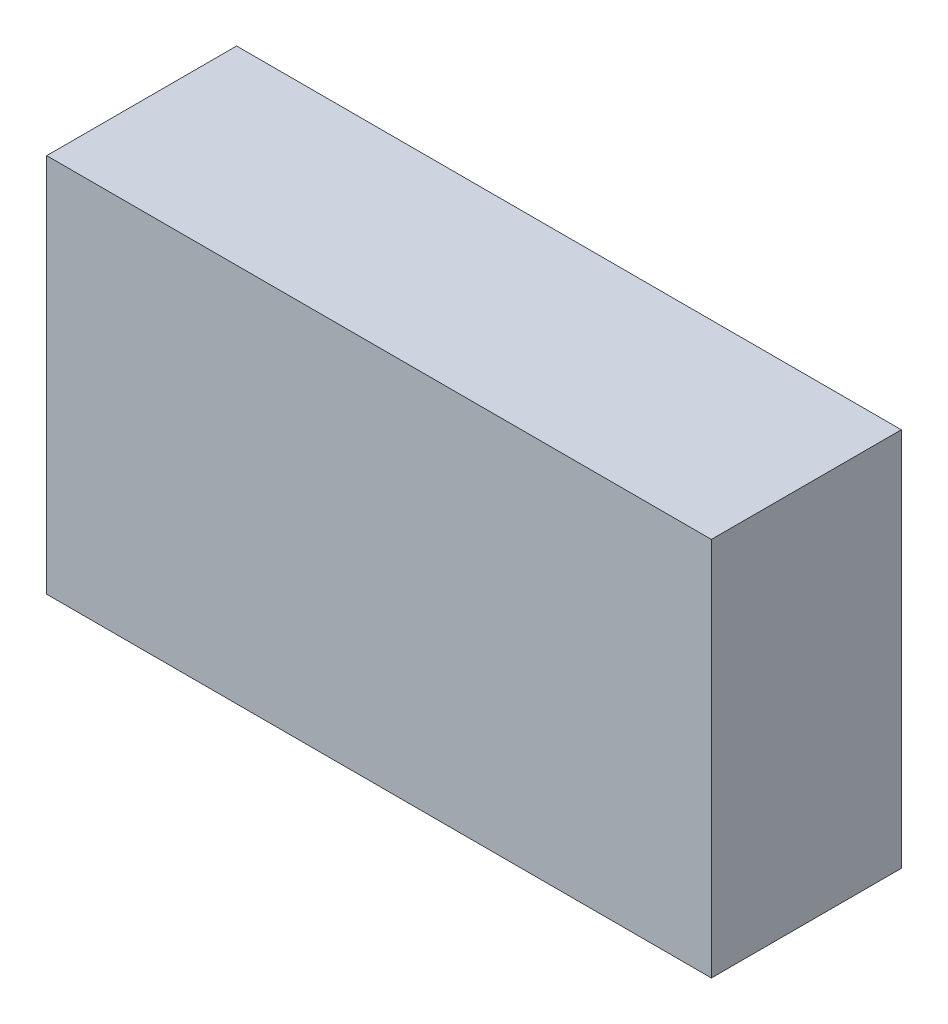
from build123d import *

# Parameters (mm, degrees)
CROQUIS1_W              = 3500
CROQUIS1_H              = 2000
SALIENTE_EXTRUIR1_DEPTH = 1000


with BuildPart() as part:
    # Croquis1 → Saliente-Extruir1 (new body)
    with BuildSketch(Plane.XY):
        with Locations((1748.16374269, 999.228070175)):
            Rectangle(CROQUIS1_W, CROQUIS1_H)
    extrude(amount=SALIENTE_EXTRUIR1_DEPTH)


solid = part.part
